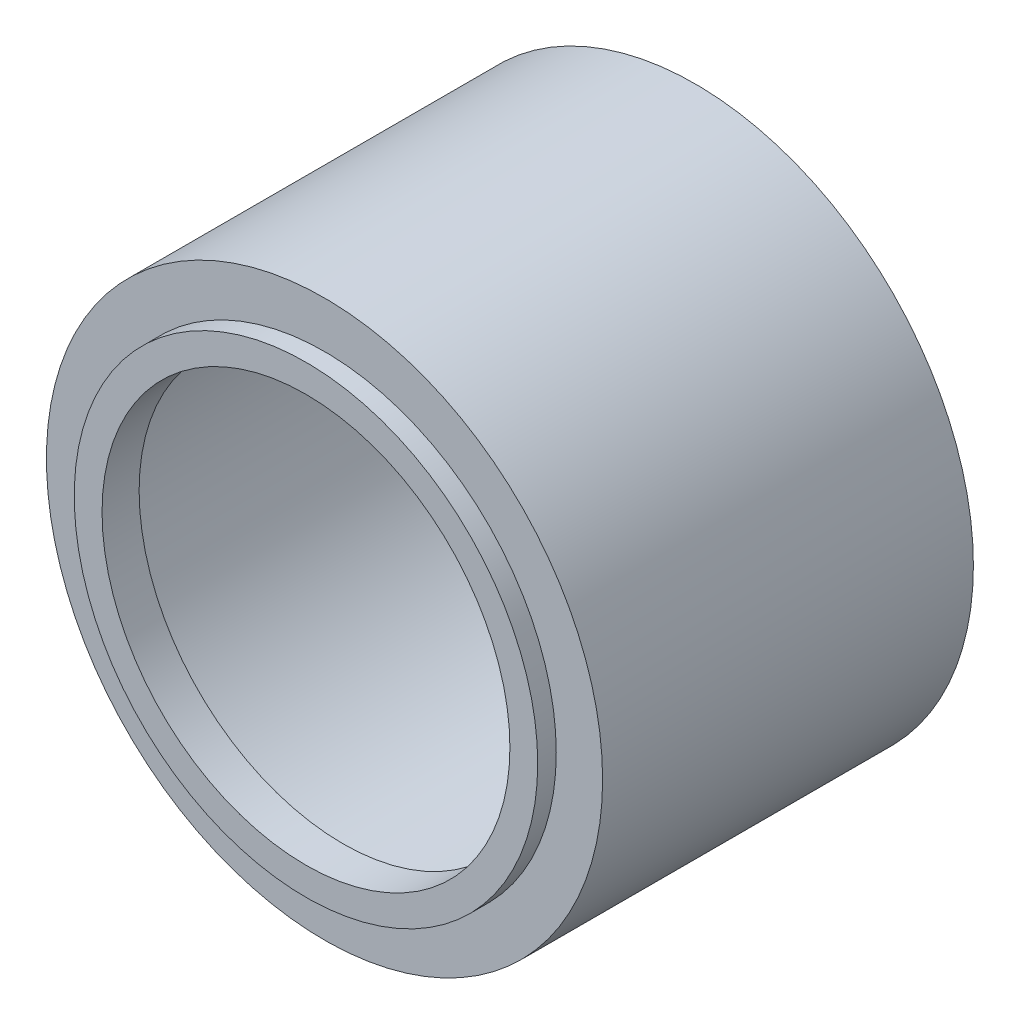
from build123d import *

# Parameters (mm, degrees)
ESQUISSE1_R             = 15
BOSS_EXTRU_1_DEPTH      = 20
ESQUISSE3_R             = 13.5
ENL_V_MAT_EXTRU_2_DEPTH = 19
ESQUISSE4_R             = 12.5
BOSS_EXTRU_2_DEPTH      = 1
ESQUISSE5_R             = 11
ENL_V_MAT_EXTRU_3_DEPTH = 2


with BuildPart() as part:
    # Esquisse1 → Boss.-Extru.1 (new body)
    with BuildSketch(Plane.XY):
        Circle(ESQUISSE1_R)
    extrude(amount=BOSS_EXTRU_1_DEPTH)

    # Esquisse3 → Enlèv. mat.-Extru.2 (cut)
    with BuildSketch(Plane(origin=(0, 0, 0), x_dir=(-1, 0, 0), z_dir=(0, 0, -1))):
        Circle(ESQUISSE3_R)
    extrude(amount=-ENL_V_MAT_EXTRU_2_DEPTH, mode=Mode.SUBTRACT)

    # Esquisse4 → Boss.-Extru.2 (add)
    with BuildSketch(Plane.XY.offset(20)):
        Circle(ESQUISSE4_R)
    extrude(amount=BOSS_EXTRU_2_DEPTH)

    # Esquisse5 → Enlèv. mat.-Extru.3 (cut)
    with BuildSketch(Plane.XY.offset(21)):
        Circle(ESQUISSE5_R)
    extrude(amount=-ENL_V_MAT_EXTRU_3_DEPTH, mode=Mode.SUBTRACT)


solid = part.part
